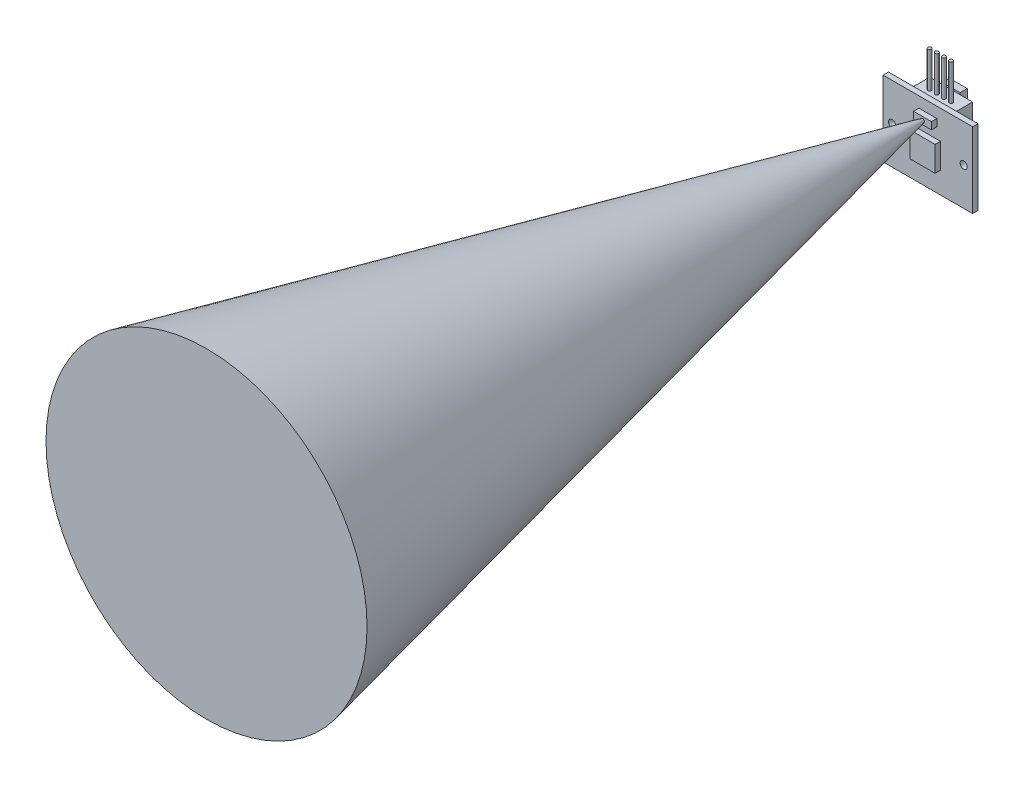
from build123d import *

# Parameters (mm, degrees)
ESQUISSE1_W          = 25
ESQUISSE1_H          = 21
ESQUISSE1_R          = 1
BOSS_EXTRU_1_DEPTH   = 1.5
ESQUISSE2_W          = 12
ESQUISSE2_H          = 10
BOSS_EXTRU_2_DEPTH   = 5
ESQUISSE3_W          = 5
ESQUISSE3_H          = 2
BOSS_EXTRU_3_DEPTH   = 1.5
ESQUISSE3_W_2        = 7
ESQUISSE3_H_2        = 7
BOSS_EXTRU_3_2_DEPTH = 1.5
ESQUISSE4_W          = 5
ESQUISSE4_H          = 8
BOSS_EXTRU_4_DEPTH   = 2
ESQUISSE5_R          = 0.5
BOSS_EXTRU_5_DEPTH   = 10
BOSS_EXTRU_5_2_DEPTH = 10
BOSS_EXTRU_5_3_DEPTH = 10
BOSS_EXTRU_5_4_DEPTH = 10
ESQUISSE6_R          = 0.5
BOSS_EXTRU_6_DEPTH   = 200
BOSS_EXTRU_6_DRAFT   = -12.5


with BuildPart() as part:
    # Esquisse1 → Boss.-Extru.1 (new body)
    with BuildSketch(Plane.XY):
        Rectangle(ESQUISSE1_W, ESQUISSE1_H)
        with Locations((-10, 0)):
            Circle(ESQUISSE1_R, mode=Mode.SUBTRACT)
        with Locations(Location((10, 0, 0), (0, 0, 180))):
            Circle(ESQUISSE1_R, mode=Mode.SUBTRACT)
    extrude(amount=BOSS_EXTRU_1_DEPTH)


with BuildPart() as body_2:
    # Esquisse2 → Boss.-Extru.2 (new body)
    with BuildSketch(Plane(origin=(0, 0, 0), x_dir=(-1, 0, 0), z_dir=(0, 0, -1))):
        with Locations((0, 5)):
            Rectangle(ESQUISSE2_W, ESQUISSE2_H)
    extrude(amount=BOSS_EXTRU_2_DEPTH)

    # Esquisse4 → Boss.-Extru.4 (add)
    with BuildSketch(Plane(origin=(0, 0, -5), x_dir=(-1, 0, 0), z_dir=(0, 0, -1))):
        with Locations((0, 6.5)):
            Rectangle(ESQUISSE4_W, ESQUISSE4_H)
    extrude(amount=BOSS_EXTRU_4_DEPTH)


with BuildPart() as body_3:
    # Esquisse3 → Boss.-Extru.3 (new body)
    with BuildSketch(Plane.XY.offset(1.5)):
        with Locations((0, 6.5)):
            Rectangle(ESQUISSE3_W, ESQUISSE3_H)
    extrude(amount=BOSS_EXTRU_3_DEPTH)


with BuildPart() as body_4:
    # Esquisse3 → Boss.-Extru.3 2 (new body)
    with BuildSketch(Plane.XY.offset(1.5)):
        with Locations((0, -1)):
            Rectangle(ESQUISSE3_W_2, ESQUISSE3_H_2)
    extrude(amount=BOSS_EXTRU_3_2_DEPTH)


with BuildPart() as body_5:
    # Esquisse5 → Boss.-Extru.5 (new body)
    with BuildSketch(Plane(origin=(0, 10, 0), x_dir=(1, 0, 0), z_dir=(0, 1, 0))):
        with Locations(Location((-3, 2, 0), (0, 0, 180))):
            Circle(ESQUISSE5_R)
    extrude(amount=BOSS_EXTRU_5_DEPTH)


with BuildPart() as body_6:
    # Esquisse5 → Boss.-Extru.5 2 (new body)
    with BuildSketch(Plane(origin=(0, 10, 0), x_dir=(1, 0, 0), z_dir=(0, 1, 0))):
        with Locations(Location((-1, 2, 0), (0, 0, 180))):
            Circle(ESQUISSE5_R)
    extrude(amount=BOSS_EXTRU_5_2_DEPTH)


with BuildPart() as body_7:
    # Esquisse5 → Boss.-Extru.5 3 (new body)
    with BuildSketch(Plane(origin=(0, 10, 0), x_dir=(1, 0, 0), z_dir=(0, 1, 0))):
        with Locations(Location((1, 2, 0), (0, 0, 180))):
            Circle(ESQUISSE5_R)
    extrude(amount=BOSS_EXTRU_5_3_DEPTH)


with BuildPart() as body_8:
    # Esquisse5 → Boss.-Extru.5 4 (new body)
    with BuildSketch(Plane(origin=(0, 10, 0), x_dir=(1, 0, 0), z_dir=(0, 1, 0))):
        with Locations(Location((3, 2, 0), (0, 0, 180))):
            Circle(ESQUISSE5_R)
    extrude(amount=BOSS_EXTRU_5_4_DEPTH)


with BuildPart() as body_9:
    # Esquisse6 → Boss.-Extru.6 (with draft: the straight prism first)
    with BuildSketch(Plane.XY.offset(3)):
        with Locations((0, 6.5)):
            Circle(ESQUISSE6_R)
    extrude(amount=BOSS_EXTRU_6_DEPTH)
    # Boss.-Extru.6: the draft: its side faces are tilted about the plane it starts from
    boss_extru_6_sides = [body_9.faces().sort_by_distance(p)[0] for p in [
        (-0.5, 6.5, 103),
    ]]
    draft(boss_extru_6_sides, Plane.XY.offset(3), BOSS_EXTRU_6_DRAFT)


solid = Compound([part.part, body_2.part, body_3.part, body_4.part, body_5.part, body_6.part, body_7.part, body_8.part, body_9.part])
